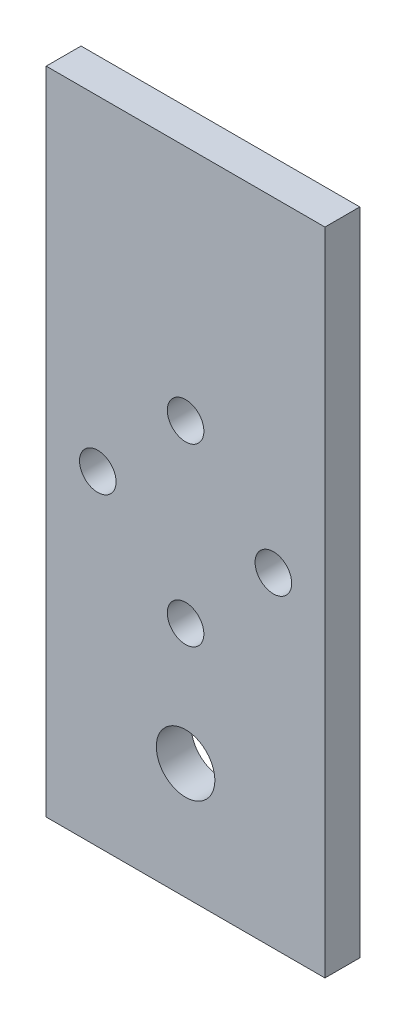
from build123d import *

# Parameters (mm, degrees)
SKETCH1_W           = 38.1
SKETCH1_H           = 88.9
SKETCH1_R           = 2.5
SKETCH1_R_2         = 4
BOSS_EXTRUDE1_DEPTH = 4.7625


with BuildPart() as part:
    # Sketch1 → Boss-Extrude1 (new body)
    with BuildSketch(Plane.XY):
        with Locations((19.05, 44.45)):
            Rectangle(SKETCH1_W, SKETCH1_H)
        with Locations(Location((19.05, 56.45, 0), (0, 0, 180))):
            Circle(SKETCH1_R, mode=Mode.SUBTRACT)
        with Locations(Location((31.05, 44.45, 0), (0, 0, 180))):
            Circle(SKETCH1_R, mode=Mode.SUBTRACT)
        with Locations(Location((19.05, 32.45, 0), (0, 0, 180))):
            Circle(SKETCH1_R, mode=Mode.SUBTRACT)
        with Locations(Location((7.05, 44.45, 0), (0, 0, 180))):
            Circle(SKETCH1_R, mode=Mode.SUBTRACT)
        with Locations(Location((19.05, 15.875, 0), (0, 0, 180))):
            Circle(SKETCH1_R_2, mode=Mode.SUBTRACT)
    extrude(amount=BOSS_EXTRUDE1_DEPTH)


solid = part.part
